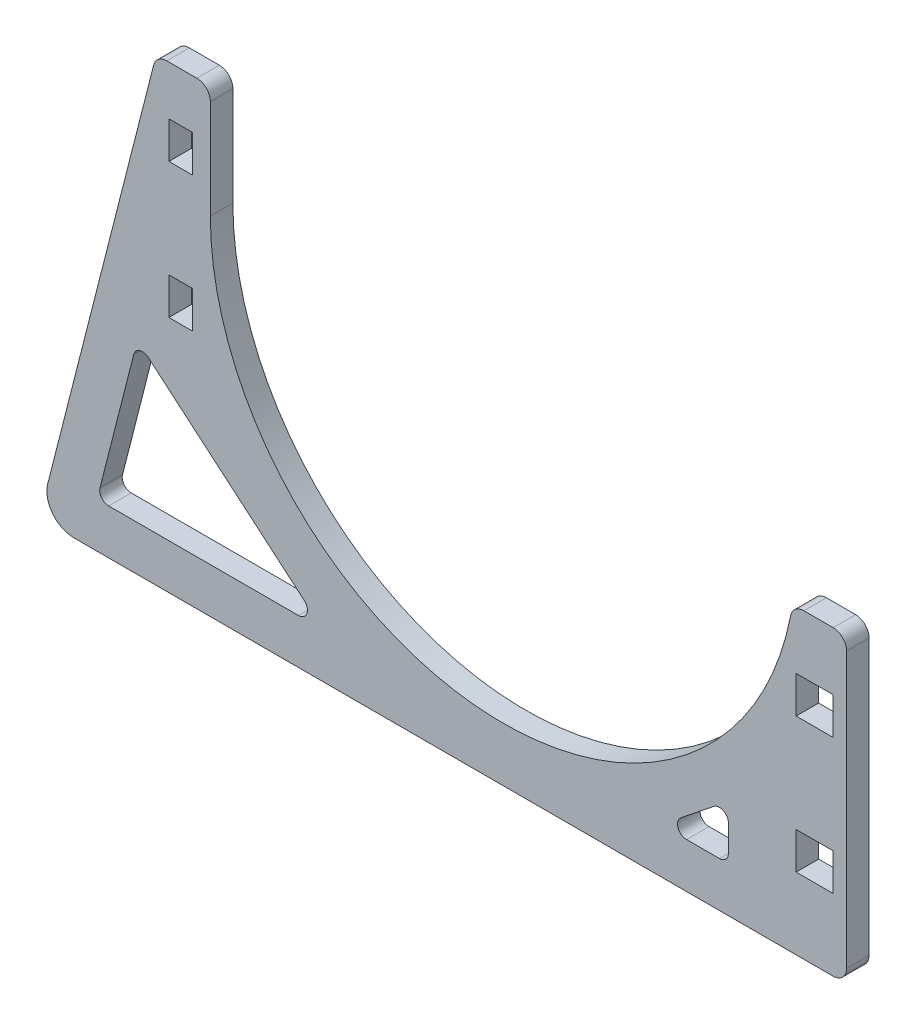
from build123d import *

# Parameters (mm, degrees)
SALIENTE_EXTRUIR1_DEPTH = 5
CORTAR_EXTRUIR3_DEPTH   = 10
REDONDEO4_R             = 2
CROQUIS3_W              = 5.2
CROQUIS3_H              = 8.2
CORTAR_EXTRUIR2_DEPTH   = 10
REDONDEO2_R             = 3
REDONDEO3_R             = 6
CROQUIS5_W              = 8.2
CROQUIS5_H              = 8.2
CORTAR_EXTRUIR4_DEPTH   = 10


with BuildPart() as part:
    # Croquis1 → Saliente-Extruir1 (new body)
    with BuildSketch(Plane.XY):
        with BuildLine():
            Line((0, 0), (-179.226162893, 0))
            Line((-179.226162893, 0), (-153.226162893, 102))
            Line((-153.226162893, 102), (-141.226162893, 102))
            Line((-141.226162893, 102), (-141.226162893, 77))
            ThreePointArc((-141.226162893, 77), (-81.241111145, 12.193748033), (-12, 67))
            Line((-12, 67), (0, 67))
            Line((0, 67), (0, 0))
        make_face()
    extrude(amount=SALIENTE_EXTRUIR1_DEPTH)

    # Croquis4 → Cortar-Extruir3 (cut)
    with BuildSketch(Plane.XY.offset(5)):
        Polygon((-166.357380645, 10), (-116.226162893, 10), (-157.435812017, 45), align=None)
        Polygon((-41.226162893, 10), (-26.226162893, 10), (-26.226162893, 22), align=None)
    extrude(amount=-CORTAR_EXTRUIR3_DEPTH, mode=Mode.SUBTRACT)

    # Redondeo4
    redondeo4_edges = [part.edges().sort_by_distance(p)[0] for p in [
        (-116.226162893, 10, 2.5),
        (-166.357380645, 10, 2.5),
        (-157.435812017, 45, 2.5),
        (-26.226162893, 22, 2.5),
        (-26.226162893, 10, 2.5),
        (-41.226162893, 10, 2.5),
    ]]
    fillet(redondeo4_edges, radius=REDONDEO4_R)

    # Croquis3 → Cortar-Extruir2 (cut)
    with BuildSketch(Plane.XY.offset(5)):
        with Locations((-147.826162893, 87)):
            Rectangle(CROQUIS3_W, CROQUIS3_H)
        with Locations((-147.826162893, 57)):
            Rectangle(CROQUIS3_W, CROQUIS3_H)
    extrude(amount=-CORTAR_EXTRUIR2_DEPTH, mode=Mode.SUBTRACT)

    # Redondeo2
    redondeo2_edges = [part.edges().sort_by_distance(p)[0] for p in [
        (-141.226162893, 102, 2.5),
        (-153.226162893, 102, 2.5),
        (0, 67, 2.5),
        (-12, 67, 2.5),
        (0, 0, 2.5),
    ]]
    fillet(redondeo2_edges, radius=REDONDEO2_R)

    # Redondeo3
    redondeo3_edges = [part.edges().sort_by_distance(p)[0] for p in [
        (-179.226162893, 0, 2.5),
    ]]
    fillet(redondeo3_edges, radius=REDONDEO3_R)

    # Croquis5 → Cortar-Extruir4 (cut)
    with BuildSketch(Plane.XY.offset(5)):
        with Locations((-7.1, 50)):
            Rectangle(CROQUIS5_W, CROQUIS5_H)
        with Locations((-7.1, 20)):
            Rectangle(CROQUIS5_W, CROQUIS5_H)
    extrude(amount=-CORTAR_EXTRUIR4_DEPTH, mode=Mode.SUBTRACT)


solid = part.part
